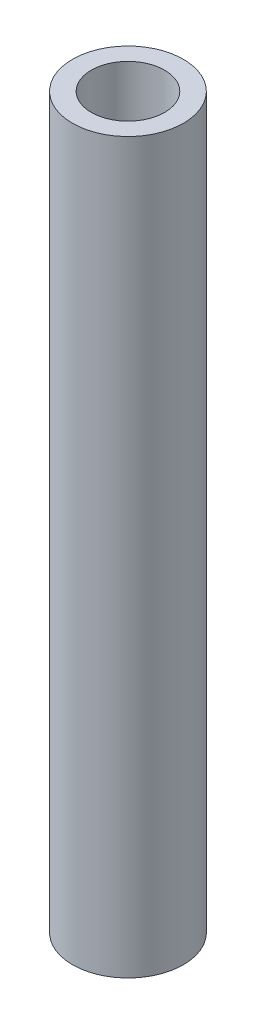
from build123d import *

# Parameters (mm, degrees)
SKETCH1_R           = 4.425
SKETCH1_R_2         = 2.925
BOSS_EXTRUDE1_DEPTH = 58.15


with BuildPart() as part:
    # Sketch1 → Boss-Extrude1 (new body)
    with BuildSketch(Plane(origin=(0, 0, 0), x_dir=(1, 0, 0), z_dir=(0, 1, 0))):
        with Locations(Location((0, 0, 0), (0, 0, 270))):
            Circle(SKETCH1_R)
        with Locations(Location((0, 0, 0), (0, 0, 270))):
            Circle(SKETCH1_R_2, mode=Mode.SUBTRACT)
    extrude(amount=-BOSS_EXTRUDE1_DEPTH)


solid = part.part
